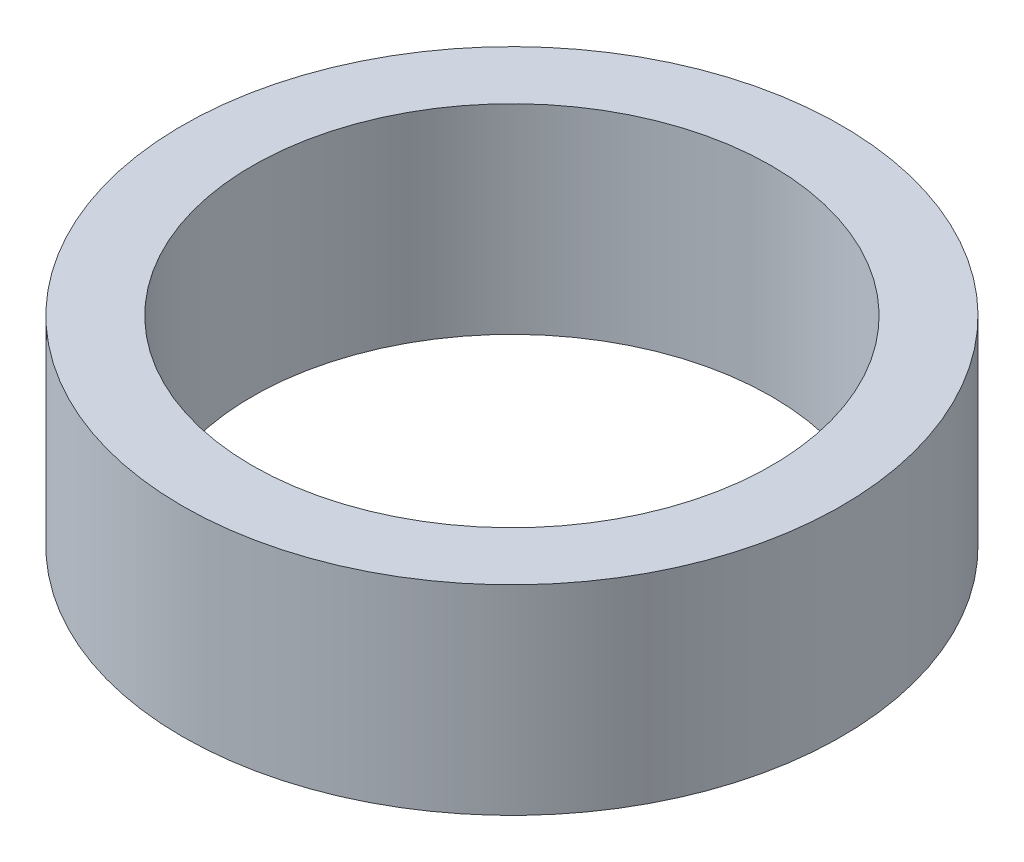
from build123d import *

# Parameters (mm, degrees)
SKETCH1_R           = 16.5
SKETCH1_R_2         = 13
BOSS_EXTRUDE2_DEPTH = 10


with BuildPart() as part:
    # Sketch1 → Boss-Extrude2 (new body)
    with BuildSketch(Plane(origin=(0, 0, 0), x_dir=(1, 0, 0), z_dir=(0, 1, 0))):
        with Locations(Location((0, 0, 0), (0, 0, 270))):
            Circle(SKETCH1_R)
        with Locations(Location((0, 0, 0), (0, 0, 270))):
            Circle(SKETCH1_R_2, mode=Mode.SUBTRACT)
    extrude(amount=BOSS_EXTRUDE2_DEPTH)


solid = part.part
